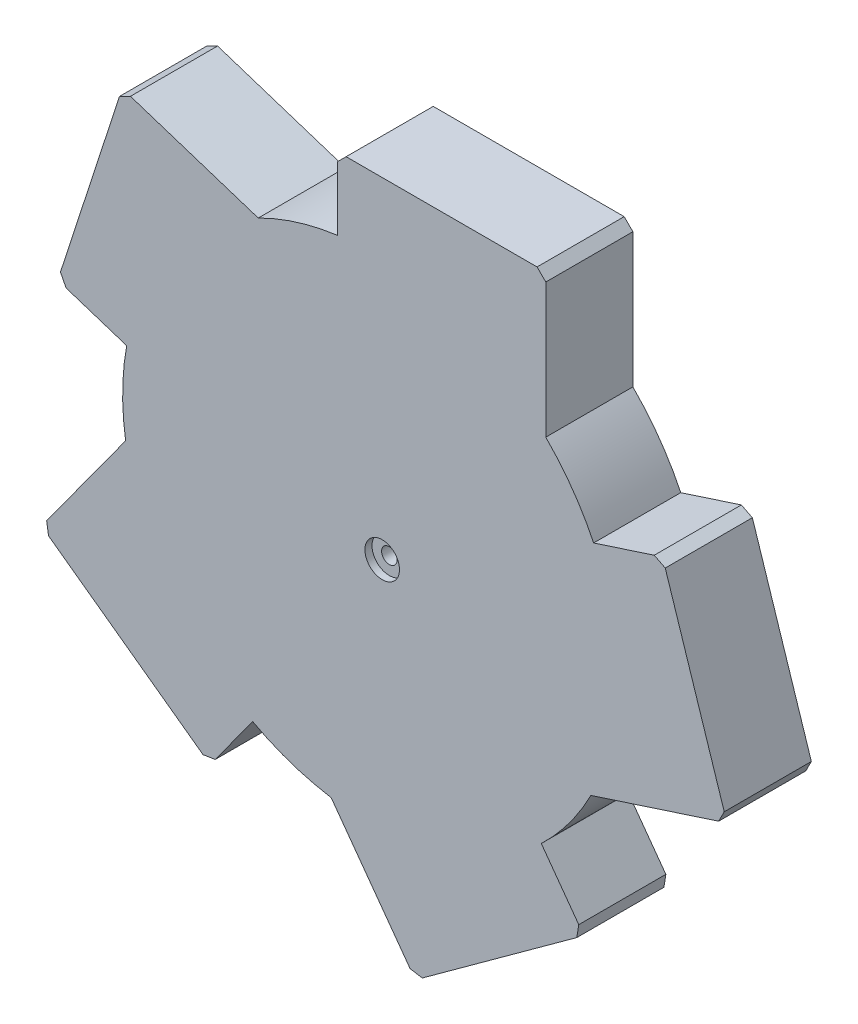
from build123d import *

# Parameters (mm, degrees)
BOSS_EXTRUDE1_DEPTH                                 = 10
CBORE_FOR_0_BINDING_HEAD_MACHINE_SCREW1_D           = 1.778
CBORE_FOR_0_BINDING_HEAD_MACHINE_SCREW1_CBORE_D     = 3.97002
CBORE_FOR_0_BINDING_HEAD_MACHINE_SCREW1_CBORE_DEPTH = 0.8128
SCALE1_SCALE                                        = 0.5
SKETCH6_R                                           = 0.4445
BOSS_EXTRUDE2_DEPTH                                 = 2


with BuildPart() as part:
    # Sketch1 → Boss-Extrude1 (new body)
    with BuildSketch(Plane.XY):
        with BuildLine():
            Line((-3.780294406, 28.180795577), (-3.780294406, 35.497024172))
            Line((-3.780294406, 35.497024172), (-2.780294406, 36.497024172))
            Line((-2.780294406, 36.497024172), (19.138659289, 36.497024172))
            Line((19.138659289, 36.497024172), (20.138659289, 35.497024172))
            Line((20.138659289, 35.497024172), (20.138659289, 20.071927342))
            ThreePointArc((20.138659289, 20.071927342), (23.213271148, 16.419254179), (25.633354053, 12.303618377))
            Line((25.633354053, 12.303618377), (32.591500933, 14.564457347))
            Line((32.591500933, 14.564457347), (33.851574443, 13.922417825))
            Line((33.851574443, 13.922417825), (40.624903634, -6.923745917))
            Line((40.624903634, -6.923745917), (39.982864112, -8.183819427))
            Line((39.982864112, -8.183819427), (25.312725257, -12.950436488))
            ThreePointArc((25.312725257, -12.950436488), (22.788933959, -17.003304214), (19.622578456, -20.576741236))
            Line((19.622578456, -20.576741236), (23.922949726, -26.495694504))
            Line((23.922949726, -26.495694504), (23.701717984, -27.89249675))
            Line((23.701717984, -27.89249675), (5.968911947, -40.776134478))
            Line((5.968911947, -40.776134478), (4.5721097, -40.554902736))
            Line((4.5721097, -40.554902736), (-4.494534732, -28.07573726))
            ThreePointArc((-4.494534732, -28.07573726), (-9.128935394, -26.927874104), (-13.50593362, -25.020743838))
            Line((-13.50593362, -25.020743838), (-17.80630489, -30.939697106))
            Line((-17.80630489, -30.939697106), (-19.203107137, -31.160928848))
            Line((-19.203107137, -31.160928848), (-36.935913175, -18.277291121))
            Line((-36.935913175, -18.277291121), (-37.157144917, -16.880488874))
            Line((-37.157144917, -16.880488874), (-28.090500485, -4.401323399))
            ThreePointArc((-28.090500485, -4.401323399), (-28.430926314, 0.360962773), (-27.969704483, 5.11307112))
            Line((-27.969704483, 5.11307112), (-34.927851363, 7.373910091))
            Line((-34.927851363, 7.373910091), (-35.569890885, 8.633983601))
            Line((-35.569890885, 8.633983601), (-28.796561694, 29.480147343))
            Line((-28.796561694, 29.480147343), (-27.536488184, 30.122186865))
            Line((-27.536488184, 30.122186865), (-12.866349329, 25.355569805))
            ThreePointArc((-12.866349329, 25.355569805), (-8.4423434, 27.150961366), (-3.780294406, 28.180795577))
        make_face()
    extrude(amount=BOSS_EXTRUDE1_DEPTH)

    # CBORE for #0 Binding Head Machine Screw1 (through all)
    with Locations(Plane.XY.offset(10)):
        with Locations((1.36318011, -1.494173462)):
            CounterBoreHole(CBORE_FOR_0_BINDING_HEAD_MACHINE_SCREW1_D / 2, CBORE_FOR_0_BINDING_HEAD_MACHINE_SCREW1_CBORE_D / 2, CBORE_FOR_0_BINDING_HEAD_MACHINE_SCREW1_CBORE_DEPTH)


with BuildPart() as part_1:
    # Scale1: scaled about (-0.001192007, 0.001306551, 4.999017146)
    add(part.part.scale(SCALE1_SCALE).moved(Location((-0.000596003, 0.000653275, 2.499508573))))


with BuildPart() as body_2:
    # Sketch6 → Boss-Extrude2 (new body)
    with BuildSketch(Plane(origin=(0, 0, 2.499508573), x_dir=(-1, 0, 0), z_dir=(0, 0, -1))):
        with Locations((-0.680994051, -0.746433455)):
            Circle(SKETCH6_R)
    extrude(amount=BOSS_EXTRUDE2_DEPTH)


solid = Compound([part_1.part, body_2.part])
